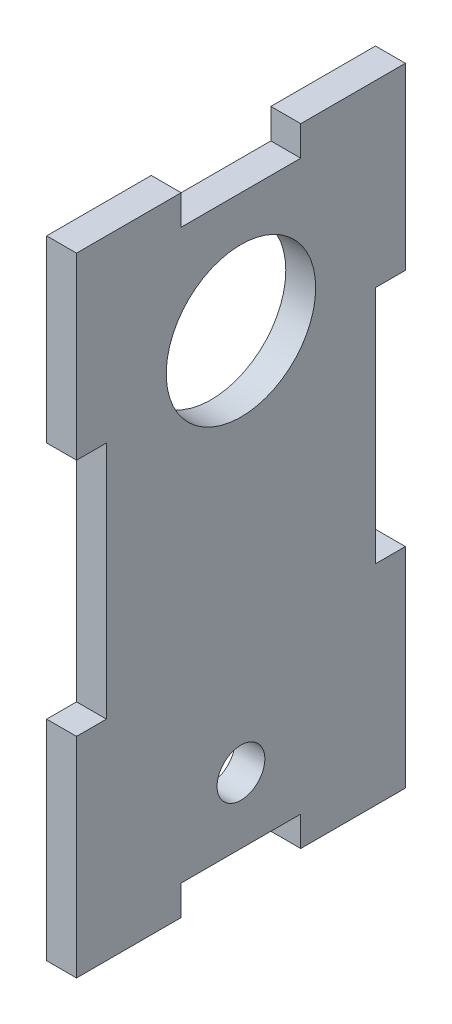
from build123d import *

# Parameters (mm, degrees)
SKETCH_1_R      = 4
SKETCH_1_R_2    = 12.5
EXTRUDE_1_DEPTH = 5


with BuildPart() as part:
    # 草图1 → 凸台-拉伸1 (new body)
    with BuildSketch(Plane(origin=(0, 0, 0), x_dir=(0, 0, -1), z_dir=(1, 0, 0))):
        Polygon((-38.937502308, 64.044466874), (-56.437502308, 64.044466874), (-56.437502308, 34.044466874), (-51.437502308, 34.044466874), (-51.437502308, -5.955533126), (-56.437502308, -5.955533126), (-56.437502308, -40.955533126), (-38.937502308, -40.955533126), (-38.937502308, -35.955533126), (-18.937502308, -35.955533126), (-18.937502308, -40.955533126), (-1.437502308, -40.955533126), (-1.437502308, -5.955533126), (-6.437502308, -5.955533126), (-6.437502308, 34.044466874), (-1.437502308, 34.044466874), (-1.437502308, 64.044466874), (-18.937502308, 64.044466874), (-18.937502308, 59.044466874), (-38.937502308, 59.044466874), align=None)
        with Locations((-28.937502308, -24.955533126)):
            Circle(SKETCH_1_R, mode=Mode.SUBTRACT)
        with Locations((-28.937502308, 39.044466874)):
            Circle(SKETCH_1_R_2, mode=Mode.SUBTRACT)
    extrude(amount=EXTRUDE_1_DEPTH)


solid = part.part
